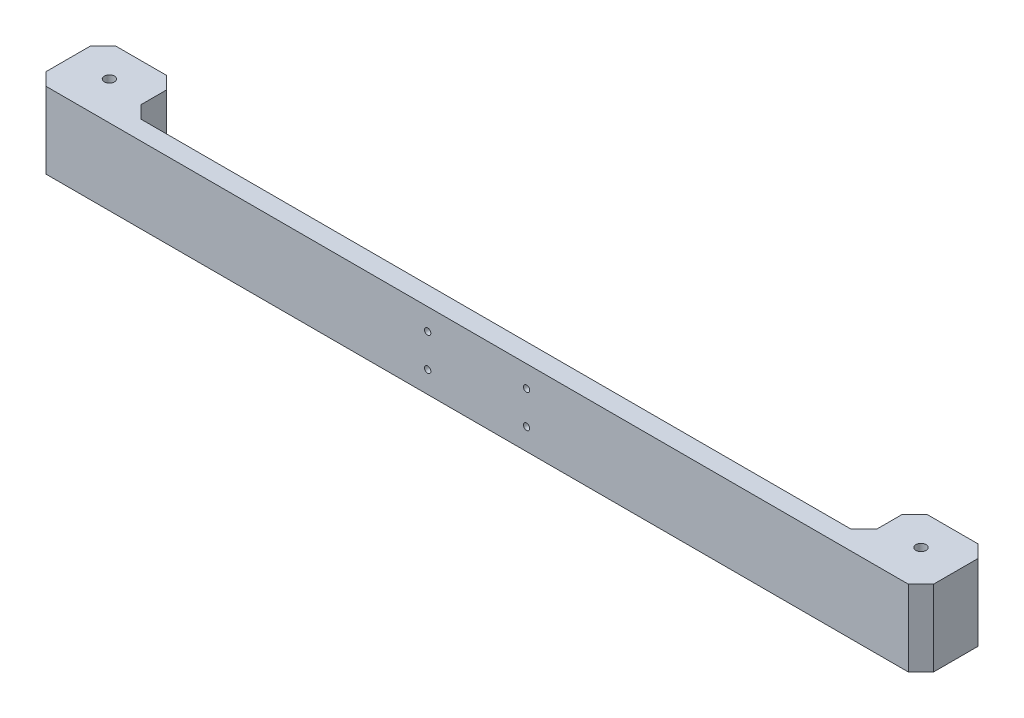
from build123d import *

# Parameters (mm, degrees)
SKETCH2_R           = 4
BOSS_EXTRUDE2_DEPTH = 60
CHAMFER3_SIZE       = 10
SKETCH3_R           = 2.5
CUT_EXTRUDE1_DEPTH  = 360.339672177


with BuildPart() as part:
    # Sketch2 → Boss-Extrude2 (new body)
    with BuildSketch(Plane(origin=(0, 0, 0), x_dir=(1, 0, 0), z_dir=(0, 1, 0))):
        Polygon((-290, 5), (-350, 5), (-350, -50), (350, -50), (350, 5), (290, 5), (290, -35), (-290, -35), align=None)
        with Locations(Location((-320, -20, 0), (0, 0, 270))):
            Circle(SKETCH2_R, mode=Mode.SUBTRACT)
        with Locations(Location((320, -20, 0), (0, 0, 270))):
            Circle(SKETCH2_R, mode=Mode.SUBTRACT)
    extrude(amount=BOSS_EXTRUDE2_DEPTH)

    # Chamfer3
    chamfer3_edges = [part.edges().sort_by_distance(p)[0] for p in [
        (290, 30, -5),
        (350, 30, -5),
        (350, 30, 50),
        (-350, 30, 50),
        (-350, 30, -5),
        (-290, 30, -5),
        (-290, 30, 35),
        (290, 30, 35),
    ]]
    chamfer(chamfer3_edges, length=CHAMFER3_SIZE)

    # Sketch3 → Cut-Extrude1 (cut, through all)
    with BuildSketch(Plane.XY.offset(50)):
        with Locations((39, 43)):
            Circle(SKETCH3_R)
        with Locations(Location((39, 17, 0), (0, 0, 180))):
            Circle(SKETCH3_R)
        with Locations((-39, 17)):
            Circle(SKETCH3_R)
        with Locations(Location((-39, 43, 0), (0, 0, 180))):
            Circle(SKETCH3_R)
    extrude(amount=-CUT_EXTRUDE1_DEPTH, mode=Mode.SUBTRACT)


solid = part.part
